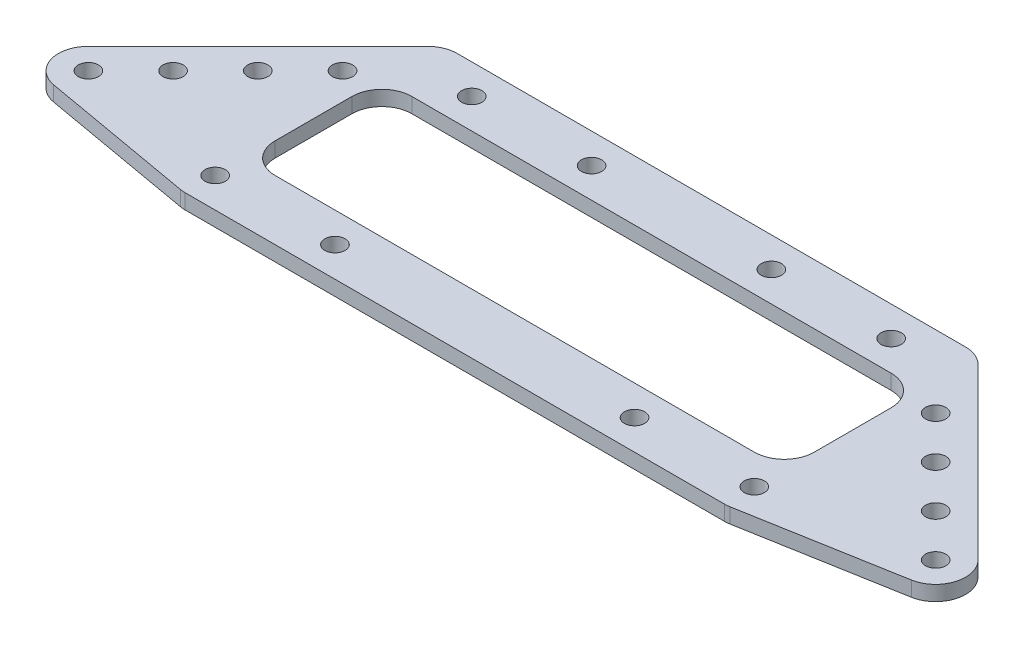
from build123d import *

# Parameters (mm, degrees)
SKETCH1_R           = 2.15
BOSS_EXTRUDE1_DEPTH = 3.175


with BuildPart() as part:
    # Sketch1 → Boss-Extrude1 (new body)
    with BuildSketch(Plane(origin=(0, 0, 0), x_dir=(1, 0, 0), z_dir=(0, 1, 0))):
        with BuildLine():
            Line((98.331536726, 6.35), (-9.431536726, 6.35))
            ThreePointArc((-9.431536726, 6.35), (-11.861576522, 5.866635031), (-13.921664787, 4.490128061))
            Line((-13.921664787, 4.490128061), (-49.842689271, -31.430896424))
            ThreePointArc((-49.842689271, -31.430896424), (-51.409271688, -37.828577417), (-46.459210265, -42.173850075))
            Line((-46.459210265, -42.173850075), (-13.806649055, -47.952825591))
            ThreePointArc((-13.806649055, -47.952825591), (-13.255453642, -48.025659748), (-12.7, -48.05))
            Line((-12.7, -48.05), (101.6, -48.05))
            ThreePointArc((101.6, -48.05), (102.155453642, -48.025659748), (102.706649055, -47.952825591))
            Line((102.706649055, -47.952825591), (135.359210265, -42.173850075))
            ThreePointArc((135.359210265, -42.173850075), (140.309271688, -37.828577417), (138.742689271, -31.430896424))
            Line((138.742689271, -31.430896424), (102.821664787, 4.490128061))
            ThreePointArc((102.821664787, 4.490128061), (100.761576522, 5.866635031), (98.331536726, 6.35))
        make_face()
        with Locations(Location((0, 0, 0), (0, 0, 270))):
            Circle(SKETCH1_R, mode=Mode.SUBTRACT)
        with Locations(Location((25.4, 0, 0), (0, 0, 270))):
            Circle(SKETCH1_R, mode=Mode.SUBTRACT)
        with Locations(Location((-18.411792847, -8.980256121, 0), (0, 0, 270))):
            Circle(SKETCH1_R, mode=Mode.SUBTRACT)
        with Locations(Location((-27.392048969, -17.960512242, 0), (0, 0, 270))):
            Circle(SKETCH1_R, mode=Mode.SUBTRACT)
        with Locations(Location((-36.37230509, -26.940768363, 0), (0, 0, 270))):
            Circle(SKETCH1_R, mode=Mode.SUBTRACT)
        with Locations(Location((-45.352561211, -35.921024484, 0), (0, 0, 270))):
            Circle(SKETCH1_R, mode=Mode.SUBTRACT)
        with Locations(Location((-12.7, -41.7, 0), (0, 0, 270))):
            Circle(SKETCH1_R, mode=Mode.SUBTRACT)
        with Locations(Location((12.7, -41.7, 0), (0, 0, 270))):
            Circle(SKETCH1_R, mode=Mode.SUBTRACT)
        with Locations(Location((63.5, 0, 0), (0, 0, 90))):
            Circle(SKETCH1_R, mode=Mode.SUBTRACT)
        with Locations(Location((88.9, 0, 0), (0, 0, 90))):
            Circle(SKETCH1_R, mode=Mode.SUBTRACT)
        with Locations(Location((107.311792847, -8.980256121, 0), (0, 0, 90))):
            Circle(SKETCH1_R, mode=Mode.SUBTRACT)
        with Locations(Location((116.292048969, -17.960512242, 0), (0, 0, 90))):
            Circle(SKETCH1_R, mode=Mode.SUBTRACT)
        with Locations(Location((134.252561211, -35.921024484, 0), (0, 0, 90))):
            Circle(SKETCH1_R, mode=Mode.SUBTRACT)
        with Locations(Location((125.27230509, -26.940768363, 0), (0, 0, 90))):
            Circle(SKETCH1_R, mode=Mode.SUBTRACT)
        with Locations(Location((76.2, -41.7, 0), (0, 0, 90))):
            Circle(SKETCH1_R, mode=Mode.SUBTRACT)
        with Locations(Location((101.6, -41.7, 0), (0, 0, 90))):
            Circle(SKETCH1_R, mode=Mode.SUBTRACT)
        with BuildLine():
            Line((95.25, -6.35), (-6.35, -6.35))
            ThreePointArc((-6.35, -6.35), (-10.840128061, -8.209871939), (-12.7, -12.7))
            Line((-12.7, -12.7), (-12.7, -29))
            ThreePointArc((-12.7, -29), (-10.840128061, -33.490128061), (-6.35, -35.35))
            Line((-6.35, -35.35), (95.25, -35.35))
            ThreePointArc((95.25, -35.35), (99.740128061, -33.490128061), (101.6, -29))
            Line((101.6, -29), (101.6, -12.7))
            ThreePointArc((101.6, -12.7), (99.740128061, -8.209871939), (95.25, -6.35))
        make_face(mode=Mode.SUBTRACT)
    extrude(amount=BOSS_EXTRUDE1_DEPTH)


solid = part.part
